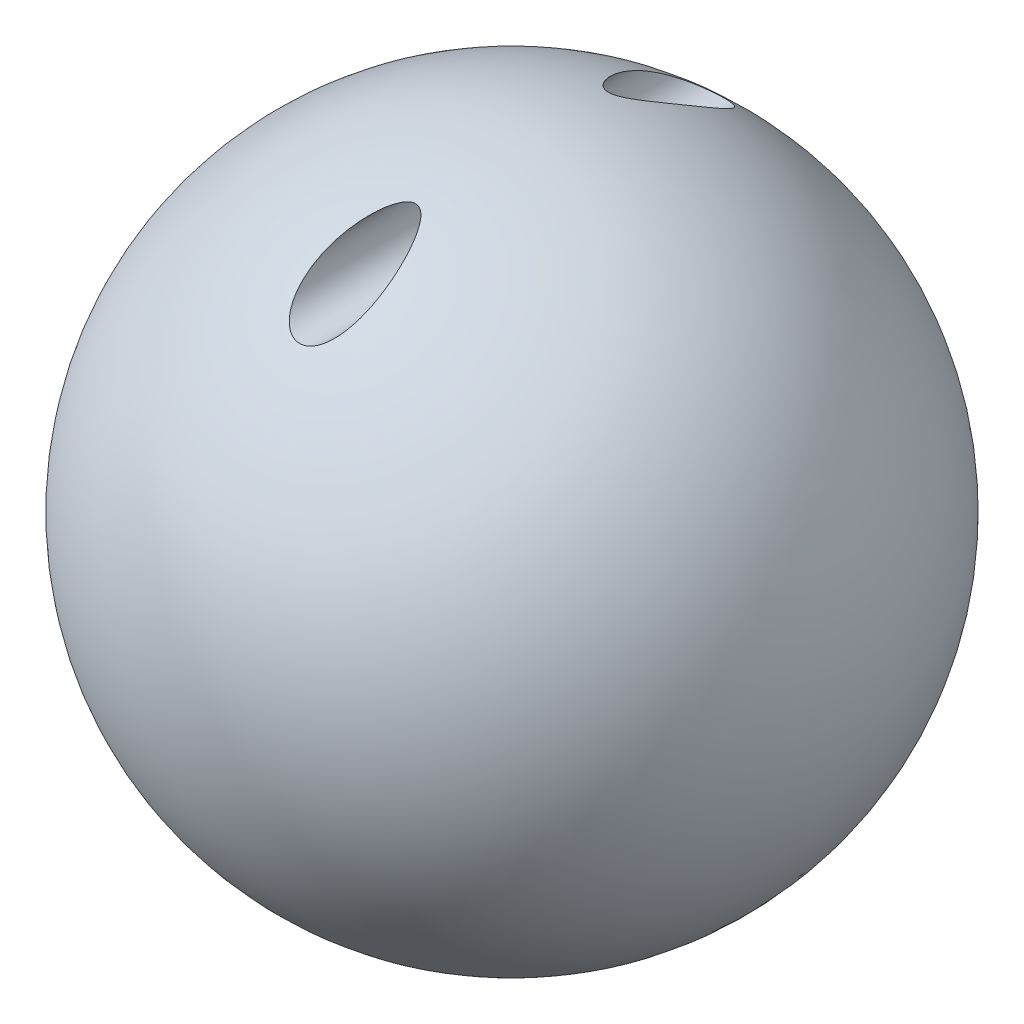
from build123d import *

# Parameters (mm, degrees)
CUT_EXTRUDE4_DEPTH      = 63.217039467
CUT_EXTRUDE4_DEPTH_BACK = 63.217039467
SKETCH4_R               = 2.431236415


with BuildPart() as part:
    # Sketch1 → Revolve1 (revolve)
    with BuildSketch(Plane.XY):
        with BuildLine():
            Line((0, 0), (0, 50.8))
            ThreePointArc((0, 50.8), (25.4, 25.4), (0, 0))
        make_face()
    revolve(axis=Axis((0, 0, 0), (0, 1, 0)))

    # Sketch4 → Cut-Extrude4 (cut, two sides: drawn at the far end of the back side and taken through both)
    with BuildSketch(Plane.XY.offset(-CUT_EXTRUDE4_DEPTH_BACK)):
        with Locations(Location((0, 47.257750457, 0), (0, 0, 108.484210302))):
            Circle(SKETCH4_R)
    extrude(amount=CUT_EXTRUDE4_DEPTH + CUT_EXTRUDE4_DEPTH_BACK, mode=Mode.SUBTRACT)


solid = part.part
